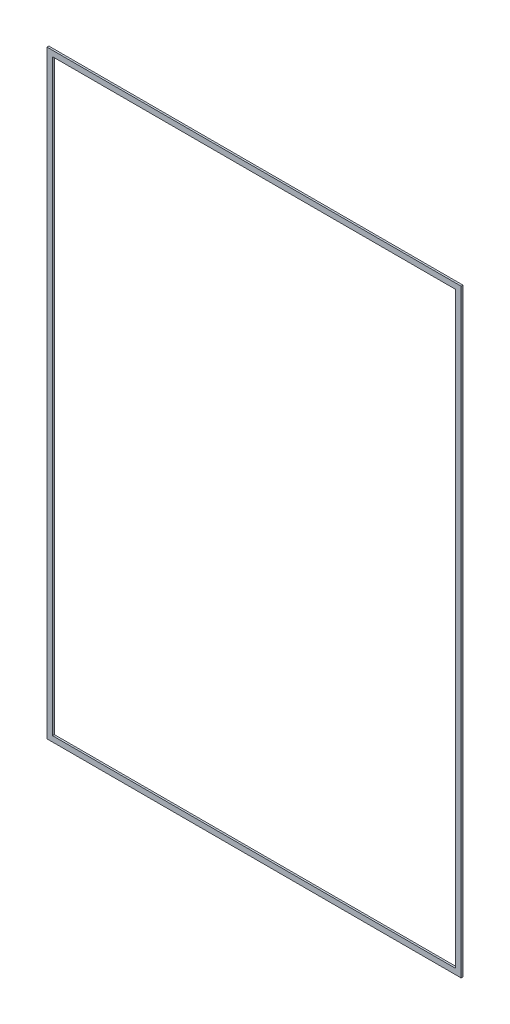
from build123d import *

# Parameters (mm, degrees)
SKETCH1_W     = 224
SKETCH1_H     = 324
SKETCH1_W_2   = 218
SKETCH1_H_2   = 318
PROFILE_DEPTH = 1


with BuildPart() as part:
    # Sketch1 → Profile (new body)
    with BuildSketch(Plane.XY):
        with Locations((112, 162)):
            Rectangle(SKETCH1_W, SKETCH1_H)
        with Locations((112, 162)):
            Rectangle(SKETCH1_W_2, SKETCH1_H_2, mode=Mode.SUBTRACT)
    extrude(amount=PROFILE_DEPTH)


solid = part.part
